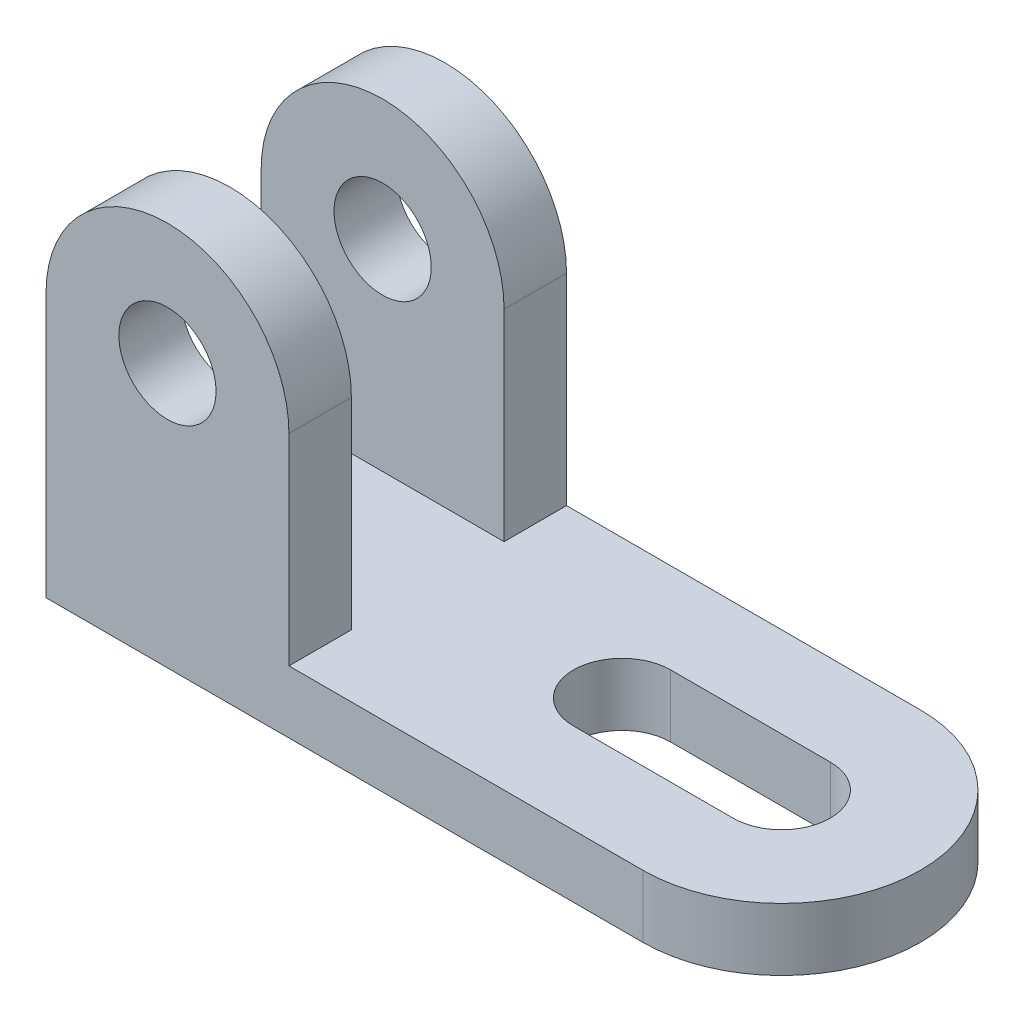
from build123d import *

# Parameters (mm, degrees)
BOSS_EXTRUDE1_DEPTH = 9
SKETCH3_W           = 35
SKETCH3_H           = 9
SKETCH3_R           = 17.5
SKETCH3_R_2         = 7
BOSS_EXTRUDE2_DEPTH = 9


with BuildPart() as part:
    # Sketch2 → Boss-Extrude1 (new body)
    with BuildSketch(Plane(origin=(0, 0, 0), x_dir=(1, 0, 0), z_dir=(0, 1, 0))):
        with BuildLine():
            Line((0, -20), (-86, -20))
            Line((-86, -20), (-86, 20))
            Line((-86, 20), (0, 20))
            ThreePointArc((0, 20), (20, 0), (0, -20))
        make_face()
        with BuildLine():
            Line((-23, 7), (0, 7))
            ThreePointArc((0, 7), (7, 0), (0, -7))
            Line((0, -7), (-23, -7))
            ThreePointArc((-23, -7), (-30, 0), (-23, 7))
        make_face(mode=Mode.SUBTRACT)
    extrude(amount=BOSS_EXTRUDE1_DEPTH)

    # Sketch3 → Boss-Extrude2 (add)
    # profile 1 of 3: a face of its own
    with BuildSketch(Plane.XY.offset(20)):
        with BuildLine():
            Line((-86, 38), (-86, 9))
            Line((-86, 9), (-51, 9))
            Line((-51, 9), (-51, 38))
            ThreePointArc((-51, 38), (-68.5, 20.5), (-86, 38))
        make_face()
    # profile 2 of 3: a face of its own
    with BuildSketch(Plane.XY.offset(20)):
        with Locations((-68.5, 4.5)):
            Rectangle(SKETCH3_W, SKETCH3_H)
    # profile 3 of 3: a face of its own
    with BuildSketch(Plane.XY.offset(20)):
        with Locations((-68.5, 38)):
            Circle(SKETCH3_R)
        with Locations((-68.5, 38)):
            Circle(SKETCH3_R_2, mode=Mode.SUBTRACT)
    boss_extrude2 = extrude(amount=-BOSS_EXTRUDE2_DEPTH)

    # Mirror1: Boss-Extrude2 across plane
    add(boss_extrude2.mirror(Plane.XY))


solid = part.part
